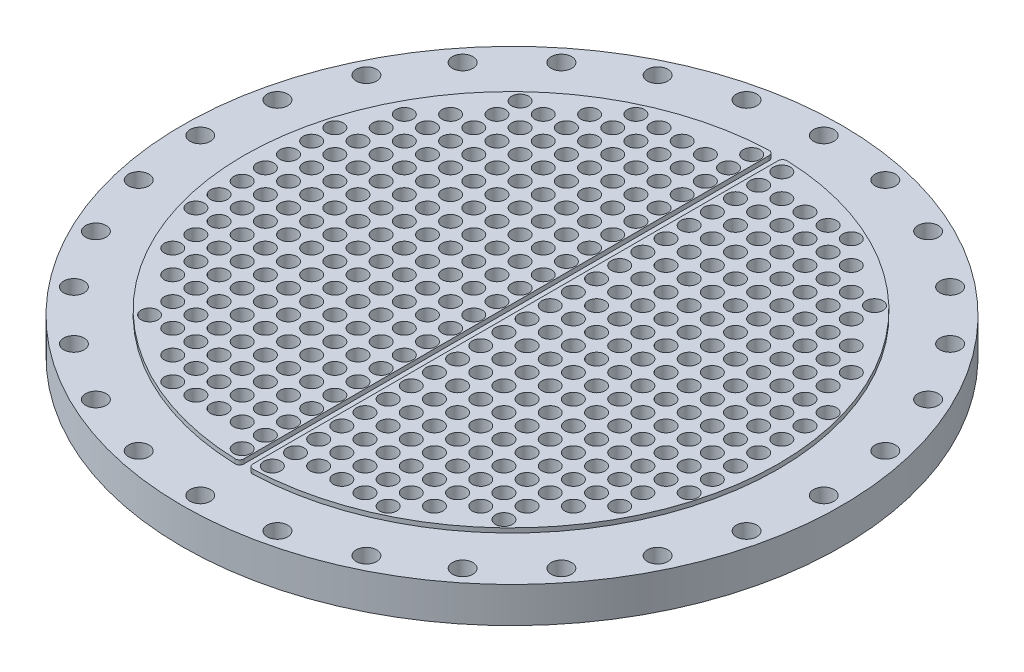
from build123d import *

# Parameters (mm, degrees)
SKETCH_2_R          = 11.5
CUT_EXTRUDE_1_DEPTH = 525.785670536
BOSS_EXTRUDE1_DEPTH = 5
SKETCH2_R           = 9.525
CUT_EXTRUDE1_DEPTH  = 526.19044165


with BuildPart() as part:
    # Эскиз1 → Повернуть1 (revolve)
    with BuildSketch(Plane.XY):
        Polygon((-300, 35), (-329, 35), (-370, 35), (-370, 75), (-300, 75), (0, 75), (0, 35), align=None)
    revolve(axis=Axis((0, 0, 0), (0, 1, 0)))

    # Эскиз2 → Вырез-Вытянуть1 (cut, through all)
    with BuildSketch(Plane(origin=(0, 75, 0), x_dir=(1, 0, 0), z_dir=(0, 1, 0))):
        with Locations((0, 350)):
            Circle(SKETCH_2_R)
        with Locations((77.882326885, 341.224769264)):
            Circle(SKETCH_2_R)
        with Locations((151.859308691, 315.339103766)):
            Circle(SKETCH_2_R)
        with Locations((218.221430651, 273.641018864)):
            Circle(SKETCH_2_R)
        with Locations((273.641018864, 218.221430651)):
            Circle(SKETCH_2_R)
        with Locations((315.339103766, 151.859308691)):
            Circle(SKETCH_2_R)
        with Locations((341.224769264, 77.882326885)):
            Circle(SKETCH_2_R)
        with Locations((350, 0)):
            Circle(SKETCH_2_R)
        with Locations((341.224769264, -77.882326885)):
            Circle(SKETCH_2_R)
        with Locations((315.339103766, -151.859308691)):
            Circle(SKETCH_2_R)
        with Locations((273.641018864, -218.221430651)):
            Circle(SKETCH_2_R)
        with Locations((218.221430651, -273.641018864)):
            Circle(SKETCH_2_R)
        with Locations((151.859308691, -315.339103766)):
            Circle(SKETCH_2_R)
        with Locations((77.882326885, -341.224769264)):
            Circle(SKETCH_2_R)
        with Locations((0, -350)):
            Circle(SKETCH_2_R)
        with Locations((-77.882326885, -341.224769264)):
            Circle(SKETCH_2_R)
        with Locations((-151.859308691, -315.339103766)):
            Circle(SKETCH_2_R)
        with Locations((-218.221430651, -273.641018864)):
            Circle(SKETCH_2_R)
        with Locations((-273.641018864, -218.221430651)):
            Circle(SKETCH_2_R)
        with Locations((-315.339103766, -151.859308691)):
            Circle(SKETCH_2_R)
        with Locations((-341.224769264, -77.882326885)):
            Circle(SKETCH_2_R)
        with Locations((-350, 0)):
            Circle(SKETCH_2_R)
        with Locations((-341.224769264, 77.882326885)):
            Circle(SKETCH_2_R)
        with Locations((-315.339103766, 151.859308691)):
            Circle(SKETCH_2_R)
        with Locations((-273.641018864, 218.221430651)):
            Circle(SKETCH_2_R)
        with Locations((-218.221430651, 273.641018864)):
            Circle(SKETCH_2_R)
        with Locations((-151.859308691, 315.339103766)):
            Circle(SKETCH_2_R)
        with Locations((-77.882326885, 341.224769264)):
            Circle(SKETCH_2_R)
    extrude(amount=-CUT_EXTRUDE_1_DEPTH, mode=Mode.SUBTRACT)

    # Sketch1 → Boss-Extrude1 (add)
    with BuildSketch(Plane(origin=(0, 75, 0), x_dir=(1, 0, 0), z_dir=(0, 1, 0))):
        with BuildLine():
            Line((3.915767562, 294.830459756), (3.915767562, -294.830459756))
            ThreePointArc((3.915767562, -294.830459756), (5.440674587, -298.425418562), (9.085259087, -299.827586193))
            ThreePointArc((9.085259087, -299.827586193), (298.915767562, 0), (9.085259087, 299.827586193))
            ThreePointArc((9.085259087, 299.827586193), (5.440674587, 298.425418562), (3.915767562, 294.830459756))
        make_face()
        with BuildLine():
            Line((-6.084232438, 294.830459756), (-6.084232438, -294.830459756))
            ThreePointArc((-6.084232438, -294.830459756), (-7.609139463, -298.425418562), (-11.253723964, -299.827586193))
            ThreePointArc((-11.253723964, -299.827586193), (-301.084232438, 0), (-11.253723964, 299.827586193))
            ThreePointArc((-11.253723964, 299.827586193), (-7.609139463, 298.425418562), (-6.084232438, 294.830459756))
        make_face()
    extrude(amount=BOSS_EXTRUDE1_DEPTH)

    # Sketch2 → Cut-Extrude1 (cut, through all)
    with BuildSketch(Plane(origin=(0, 80, 0), x_dir=(1, 0, 0), z_dir=(0, 1, 0))):
        with Locations((16.915767562, 0)):
            Circle(SKETCH2_R)
        with Locations((42.915767562, 0)):
            Circle(SKETCH2_R)
        with Locations((68.915767562, 0)):
            Circle(SKETCH2_R)
        with Locations((94.915767562, 0)):
            Circle(SKETCH2_R)
        with Locations((120.915767562, 0)):
            Circle(SKETCH2_R)
        with Locations((146.915767562, 0)):
            Circle(SKETCH2_R)
        with Locations((172.915767562, 0)):
            Circle(SKETCH2_R)
        with Locations((198.915767562, 0)):
            Circle(SKETCH2_R)
        with Locations((224.915767562, 0)):
            Circle(SKETCH2_R)
        with Locations((250.915767562, 0)):
            Circle(SKETCH2_R)
        with Locations((276.915767562, 0)):
            Circle(SKETCH2_R)
        with Locations((42.915767562, 26)):
            Circle(SKETCH2_R)
        with Locations((68.915767562, 26)):
            Circle(SKETCH2_R)
        with Locations((94.915767562, 26)):
            Circle(SKETCH2_R)
        with Locations((120.915767562, 26)):
            Circle(SKETCH2_R)
        with Locations((146.915767562, 26)):
            Circle(SKETCH2_R)
        with Locations((172.915767562, 26)):
            Circle(SKETCH2_R)
        with Locations((198.915767562, 26)):
            Circle(SKETCH2_R)
        with Locations((224.915767562, 26)):
            Circle(SKETCH2_R)
        with Locations((250.915767562, 26)):
            Circle(SKETCH2_R)
        with Locations((276.915767562, 26)):
            Circle(SKETCH2_R)
        with Locations((42.915767562, 52)):
            Circle(SKETCH2_R)
        with Locations((68.915767562, 52)):
            Circle(SKETCH2_R)
        with Locations((94.915767562, 52)):
            Circle(SKETCH2_R)
        with Locations((120.915767562, 52)):
            Circle(SKETCH2_R)
        with Locations((146.915767562, 52)):
            Circle(SKETCH2_R)
        with Locations((172.915767562, 52)):
            Circle(SKETCH2_R)
        with Locations((198.915767562, 52)):
            Circle(SKETCH2_R)
        with Locations((224.915767562, 52)):
            Circle(SKETCH2_R)
        with Locations((250.915767562, 52)):
            Circle(SKETCH2_R)
        with Locations((276.915767562, 52)):
            Circle(SKETCH2_R)
        with Locations((42.915767562, 78)):
            Circle(SKETCH2_R)
        with Locations((68.915767562, 78)):
            Circle(SKETCH2_R)
        with Locations((94.915767562, 78)):
            Circle(SKETCH2_R)
        with Locations((120.915767562, 78)):
            Circle(SKETCH2_R)
        with Locations((146.915767562, 78)):
            Circle(SKETCH2_R)
        with Locations((172.915767562, 78)):
            Circle(SKETCH2_R)
        with Locations((198.915767562, 78)):
            Circle(SKETCH2_R)
        with Locations((224.915767562, 78)):
            Circle(SKETCH2_R)
        with Locations((250.915767562, 78)):
            Circle(SKETCH2_R)
        with Locations((276.915767562, 78)):
            Circle(SKETCH2_R)
        with Locations((42.915767562, 104)):
            Circle(SKETCH2_R)
        with Locations((68.915767562, 104)):
            Circle(SKETCH2_R)
        with Locations((94.915767562, 104)):
            Circle(SKETCH2_R)
        with Locations((120.915767562, 104)):
            Circle(SKETCH2_R)
        with Locations((146.915767562, 104)):
            Circle(SKETCH2_R)
        with Locations((172.915767562, 104)):
            Circle(SKETCH2_R)
        with Locations((198.915767562, 104)):
            Circle(SKETCH2_R)
        with Locations((224.915767562, 104)):
            Circle(SKETCH2_R)
        with Locations((250.915767562, 104)):
            Circle(SKETCH2_R)
        with Locations((16.915767562, -286)):
            Circle(SKETCH2_R)
        with Locations((42.915767562, 130)):
            Circle(SKETCH2_R)
        with Locations((68.915767562, 130)):
            Circle(SKETCH2_R)
        with Locations((94.915767562, 130)):
            Circle(SKETCH2_R)
        with Locations((120.915767562, 130)):
            Circle(SKETCH2_R)
        with Locations((146.915767562, 130)):
            Circle(SKETCH2_R)
        with Locations((172.915767562, 130)):
            Circle(SKETCH2_R)
        with Locations((198.915767562, 130)):
            Circle(SKETCH2_R)
        with Locations((224.915767562, 130)):
            Circle(SKETCH2_R)
        with Locations((250.915767562, 130)):
            Circle(SKETCH2_R)
        with Locations((16.915767562, -260)):
            Circle(SKETCH2_R)
        with Locations((42.915767562, 156)):
            Circle(SKETCH2_R)
        with Locations((68.915767562, 156)):
            Circle(SKETCH2_R)
        with Locations((94.915767562, 156)):
            Circle(SKETCH2_R)
        with Locations((120.915767562, 156)):
            Circle(SKETCH2_R)
        with Locations((146.915767562, 156)):
            Circle(SKETCH2_R)
        with Locations((172.915767562, 156)):
            Circle(SKETCH2_R)
        with Locations((198.915767562, 156)):
            Circle(SKETCH2_R)
        with Locations((224.915767562, 156)):
            Circle(SKETCH2_R)
        with Locations((16.915767562, -234)):
            Circle(SKETCH2_R)
        with Locations((16.915767562, -208)):
            Circle(SKETCH2_R)
        with Locations((42.915767562, 182)):
            Circle(SKETCH2_R)
        with Locations((68.915767562, 182)):
            Circle(SKETCH2_R)
        with Locations((94.915767562, 182)):
            Circle(SKETCH2_R)
        with Locations((120.915767562, 182)):
            Circle(SKETCH2_R)
        with Locations((146.915767562, 182)):
            Circle(SKETCH2_R)
        with Locations((172.915767562, 182)):
            Circle(SKETCH2_R)
        with Locations((198.915767562, 182)):
            Circle(SKETCH2_R)
        with Locations((16.915767562, -182)):
            Circle(SKETCH2_R)
        with Locations((16.915767562, -156)):
            Circle(SKETCH2_R)
        with Locations((16.915767562, -130)):
            Circle(SKETCH2_R)
        with Locations((42.915767562, 208)):
            Circle(SKETCH2_R)
        with Locations((68.915767562, 208)):
            Circle(SKETCH2_R)
        with Locations((94.915767562, 208)):
            Circle(SKETCH2_R)
        with Locations((120.915767562, 208)):
            Circle(SKETCH2_R)
        with Locations((146.915767562, 208)):
            Circle(SKETCH2_R)
        with Locations((172.915767562, 208)):
            Circle(SKETCH2_R)
        with Locations((198.915767562, 208)):
            Circle(SKETCH2_R)
        with Locations((16.915767562, -104)):
            Circle(SKETCH2_R)
        with Locations((16.915767562, -78)):
            Circle(SKETCH2_R)
        with Locations((16.915767562, -52)):
            Circle(SKETCH2_R)
        with Locations((42.915767562, 234)):
            Circle(SKETCH2_R)
        with Locations((68.915767562, 234)):
            Circle(SKETCH2_R)
        with Locations((94.915767562, 234)):
            Circle(SKETCH2_R)
        with Locations((120.915767562, 234)):
            Circle(SKETCH2_R)
        with Locations((146.915767562, 234)):
            Circle(SKETCH2_R)
        with Locations((16.915767562, -26)):
            Circle(SKETCH2_R)
        with Locations((120.915767562, -260)):
            Circle(SKETCH2_R)
        with Locations((94.915767562, -260)):
            Circle(SKETCH2_R)
        with Locations((68.915767562, -260)):
            Circle(SKETCH2_R)
        with Locations((42.915767562, -260)):
            Circle(SKETCH2_R)
        with Locations((42.915767562, 260)):
            Circle(SKETCH2_R)
        with Locations((68.915767562, 260)):
            Circle(SKETCH2_R)
        with Locations((94.915767562, 260)):
            Circle(SKETCH2_R)
        with Locations((120.915767562, 260)):
            Circle(SKETCH2_R)
        with Locations((146.915767562, -234)):
            Circle(SKETCH2_R)
        with Locations((120.915767562, -234)):
            Circle(SKETCH2_R)
        with Locations((94.915767562, -234)):
            Circle(SKETCH2_R)
        with Locations((68.915767562, -234)):
            Circle(SKETCH2_R)
        with Locations((42.915767562, -234)):
            Circle(SKETCH2_R)
        with Locations((198.915767562, -208)):
            Circle(SKETCH2_R)
        with Locations((172.915767562, -208)):
            Circle(SKETCH2_R)
        with Locations((146.915767562, -208)):
            Circle(SKETCH2_R)
        with Locations((120.915767562, -208)):
            Circle(SKETCH2_R)
        with Locations((94.915767562, -208)):
            Circle(SKETCH2_R)
        with Locations((68.915767562, -208)):
            Circle(SKETCH2_R)
        with Locations((42.915767562, -208)):
            Circle(SKETCH2_R)
        with Locations((198.915767562, -182)):
            Circle(SKETCH2_R)
        with Locations((172.915767562, -182)):
            Circle(SKETCH2_R)
        with Locations((146.915767562, -182)):
            Circle(SKETCH2_R)
        with Locations((120.915767562, -182)):
            Circle(SKETCH2_R)
        with Locations((16.915767562, 26)):
            Circle(SKETCH2_R)
        with Locations((16.915767562, 52)):
            Circle(SKETCH2_R)
        with Locations((16.915767562, 78)):
            Circle(SKETCH2_R)
        with Locations((16.915767562, 104)):
            Circle(SKETCH2_R)
        with Locations((16.915767562, 130)):
            Circle(SKETCH2_R)
        with Locations((16.915767562, 156)):
            Circle(SKETCH2_R)
        with Locations((16.915767562, 182)):
            Circle(SKETCH2_R)
        with Locations((16.915767562, 208)):
            Circle(SKETCH2_R)
        with Locations((16.915767562, 234)):
            Circle(SKETCH2_R)
        with Locations((16.915767562, 260)):
            Circle(SKETCH2_R)
        with Locations((16.915767562, 286)):
            Circle(SKETCH2_R)
        with Locations((94.915767562, -182)):
            Circle(SKETCH2_R)
        with Locations((68.915767562, -182)):
            Circle(SKETCH2_R)
        with Locations((42.915767562, -182)):
            Circle(SKETCH2_R)
        with Locations((224.915767562, -156)):
            Circle(SKETCH2_R)
        with Locations((198.915767562, -156)):
            Circle(SKETCH2_R)
        with Locations((172.915767562, -156)):
            Circle(SKETCH2_R)
        with Locations((146.915767562, -156)):
            Circle(SKETCH2_R)
        with Locations((120.915767562, -156)):
            Circle(SKETCH2_R)
        with Locations((94.915767562, -156)):
            Circle(SKETCH2_R)
        with Locations((68.915767562, -156)):
            Circle(SKETCH2_R)
        with Locations((42.915767562, -156)):
            Circle(SKETCH2_R)
        with Locations((250.915767562, -130)):
            Circle(SKETCH2_R)
        with Locations((224.915767562, -130)):
            Circle(SKETCH2_R)
        with Locations((198.915767562, -130)):
            Circle(SKETCH2_R)
        with Locations((172.915767562, -130)):
            Circle(SKETCH2_R)
        with Locations((146.915767562, -130)):
            Circle(SKETCH2_R)
        with Locations((120.915767562, -130)):
            Circle(SKETCH2_R)
        with Locations((94.915767562, -130)):
            Circle(SKETCH2_R)
        with Locations((68.915767562, -130)):
            Circle(SKETCH2_R)
        with Locations((42.915767562, -130)):
            Circle(SKETCH2_R)
        with Locations((250.915767562, -104)):
            Circle(SKETCH2_R)
        with Locations((224.915767562, -104)):
            Circle(SKETCH2_R)
        with Locations((198.915767562, -104)):
            Circle(SKETCH2_R)
        with Locations((172.915767562, -104)):
            Circle(SKETCH2_R)
        with Locations((146.915767562, -104)):
            Circle(SKETCH2_R)
        with Locations((120.915767562, -104)):
            Circle(SKETCH2_R)
        with Locations((94.915767562, -104)):
            Circle(SKETCH2_R)
        with Locations((68.915767562, -104)):
            Circle(SKETCH2_R)
        with Locations((42.915767562, -104)):
            Circle(SKETCH2_R)
        with Locations((276.915767562, -78)):
            Circle(SKETCH2_R)
        with Locations((250.915767562, -78)):
            Circle(SKETCH2_R)
        with Locations((224.915767562, -78)):
            Circle(SKETCH2_R)
        with Locations((198.915767562, -78)):
            Circle(SKETCH2_R)
        with Locations((172.915767562, -78)):
            Circle(SKETCH2_R)
        with Locations((146.915767562, -78)):
            Circle(SKETCH2_R)
        with Locations((120.915767562, -78)):
            Circle(SKETCH2_R)
        with Locations((94.915767562, -78)):
            Circle(SKETCH2_R)
        with Locations((68.915767562, -78)):
            Circle(SKETCH2_R)
        with Locations((42.915767562, -78)):
            Circle(SKETCH2_R)
        with Locations((276.915767562, -52)):
            Circle(SKETCH2_R)
        with Locations((250.915767562, -52)):
            Circle(SKETCH2_R)
        with Locations((224.915767562, -52)):
            Circle(SKETCH2_R)
        with Locations((198.915767562, -52)):
            Circle(SKETCH2_R)
        with Locations((172.915767562, -52)):
            Circle(SKETCH2_R)
        with Locations((146.915767562, -52)):
            Circle(SKETCH2_R)
        with Locations((120.915767562, -52)):
            Circle(SKETCH2_R)
        with Locations((94.915767562, -52)):
            Circle(SKETCH2_R)
        with Locations((68.915767562, -52)):
            Circle(SKETCH2_R)
        with Locations((42.915767562, -52)):
            Circle(SKETCH2_R)
        with Locations((276.915767562, -26)):
            Circle(SKETCH2_R)
        with Locations((250.915767562, -26)):
            Circle(SKETCH2_R)
        with Locations((224.915767562, -26)):
            Circle(SKETCH2_R)
        with Locations((198.915767562, -26)):
            Circle(SKETCH2_R)
        with Locations((172.915767562, -26)):
            Circle(SKETCH2_R)
        with Locations((146.915767562, -26)):
            Circle(SKETCH2_R)
        with Locations((120.915767562, -26)):
            Circle(SKETCH2_R)
        with Locations((94.915767562, -26)):
            Circle(SKETCH2_R)
        with Locations((68.915767562, -26)):
            Circle(SKETCH2_R)
        with Locations((42.915767562, -26)):
            Circle(SKETCH2_R)
        with Locations((-42.915767562, -26)):
            Circle(SKETCH2_R)
        with Locations((-68.915767562, -26)):
            Circle(SKETCH2_R)
        with Locations((-94.915767562, -26)):
            Circle(SKETCH2_R)
        with Locations((-120.915767562, -26)):
            Circle(SKETCH2_R)
        with Locations((-146.915767562, -26)):
            Circle(SKETCH2_R)
        with Locations((-172.915767562, -26)):
            Circle(SKETCH2_R)
        with Locations((-198.915767562, -26)):
            Circle(SKETCH2_R)
        with Locations((-224.915767562, -26)):
            Circle(SKETCH2_R)
        with Locations((-250.915767562, -26)):
            Circle(SKETCH2_R)
        with Locations((-276.915767562, -26)):
            Circle(SKETCH2_R)
        with Locations((-42.915767562, -52)):
            Circle(SKETCH2_R)
        with Locations((-68.915767562, -52)):
            Circle(SKETCH2_R)
        with Locations((-94.915767562, -52)):
            Circle(SKETCH2_R)
        with Locations((-120.915767562, -52)):
            Circle(SKETCH2_R)
        with Locations((-146.915767562, -52)):
            Circle(SKETCH2_R)
        with Locations((-172.915767562, -52)):
            Circle(SKETCH2_R)
        with Locations((-198.915767562, -52)):
            Circle(SKETCH2_R)
        with Locations((-224.915767562, -52)):
            Circle(SKETCH2_R)
        with Locations((-250.915767562, -52)):
            Circle(SKETCH2_R)
        with Locations((-276.915767562, -52)):
            Circle(SKETCH2_R)
        with Locations((-42.915767562, -78)):
            Circle(SKETCH2_R)
        with Locations((-68.915767562, -78)):
            Circle(SKETCH2_R)
        with Locations((-94.915767562, -78)):
            Circle(SKETCH2_R)
        with Locations((-120.915767562, -78)):
            Circle(SKETCH2_R)
        with Locations((-146.915767562, -78)):
            Circle(SKETCH2_R)
        with Locations((-172.915767562, -78)):
            Circle(SKETCH2_R)
        with Locations((-198.915767562, -78)):
            Circle(SKETCH2_R)
        with Locations((-224.915767562, -78)):
            Circle(SKETCH2_R)
        with Locations((-250.915767562, -78)):
            Circle(SKETCH2_R)
        with Locations((-276.915767562, -78)):
            Circle(SKETCH2_R)
        with Locations((-42.915767562, -104)):
            Circle(SKETCH2_R)
        with Locations((-68.915767562, -104)):
            Circle(SKETCH2_R)
        with Locations((-94.915767562, -104)):
            Circle(SKETCH2_R)
        with Locations((-120.915767562, -104)):
            Circle(SKETCH2_R)
        with Locations((-146.915767562, -104)):
            Circle(SKETCH2_R)
        with Locations((-172.915767562, -104)):
            Circle(SKETCH2_R)
        with Locations((-198.915767562, -104)):
            Circle(SKETCH2_R)
        with Locations((-224.915767562, -104)):
            Circle(SKETCH2_R)
        with Locations((-250.915767562, -104)):
            Circle(SKETCH2_R)
        with Locations((-42.915767562, -130)):
            Circle(SKETCH2_R)
        with Locations((-68.915767562, -130)):
            Circle(SKETCH2_R)
        with Locations((-94.915767562, -130)):
            Circle(SKETCH2_R)
        with Locations((-120.915767562, -130)):
            Circle(SKETCH2_R)
        with Locations((-146.915767562, -130)):
            Circle(SKETCH2_R)
        with Locations((-172.915767562, -130)):
            Circle(SKETCH2_R)
        with Locations((-198.915767562, -130)):
            Circle(SKETCH2_R)
        with Locations((-224.915767562, -130)):
            Circle(SKETCH2_R)
        with Locations((-250.915767562, -130)):
            Circle(SKETCH2_R)
        with Locations((-42.915767562, -156)):
            Circle(SKETCH2_R)
        with Locations((-68.915767562, -156)):
            Circle(SKETCH2_R)
        with Locations((-94.915767562, -156)):
            Circle(SKETCH2_R)
        with Locations((-120.915767562, -156)):
            Circle(SKETCH2_R)
        with Locations((-146.915767562, -156)):
            Circle(SKETCH2_R)
        with Locations((-172.915767562, -156)):
            Circle(SKETCH2_R)
        with Locations((-198.915767562, -156)):
            Circle(SKETCH2_R)
        with Locations((-224.915767562, -156)):
            Circle(SKETCH2_R)
        with Locations((-42.915767562, -182)):
            Circle(SKETCH2_R)
        with Locations((-68.915767562, -182)):
            Circle(SKETCH2_R)
        with Locations((-94.915767562, -182)):
            Circle(SKETCH2_R)
        with Locations((-16.915767562, 286)):
            Circle(SKETCH2_R)
        with Locations((-16.915767562, 260)):
            Circle(SKETCH2_R)
        with Locations((-16.915767562, 234)):
            Circle(SKETCH2_R)
        with Locations((-16.915767562, 208)):
            Circle(SKETCH2_R)
        with Locations((-16.915767562, 182)):
            Circle(SKETCH2_R)
        with Locations((-16.915767562, 156)):
            Circle(SKETCH2_R)
        with Locations((-16.915767562, 130)):
            Circle(SKETCH2_R)
        with Locations((-16.915767562, 104)):
            Circle(SKETCH2_R)
        with Locations((-16.915767562, 78)):
            Circle(SKETCH2_R)
        with Locations((-16.915767562, 52)):
            Circle(SKETCH2_R)
        with Locations((-16.915767562, 26)):
            Circle(SKETCH2_R)
        with Locations((-120.915767562, -182)):
            Circle(SKETCH2_R)
        with Locations((-146.915767562, -182)):
            Circle(SKETCH2_R)
        with Locations((-172.915767562, -182)):
            Circle(SKETCH2_R)
        with Locations((-198.915767562, -182)):
            Circle(SKETCH2_R)
        with Locations((-42.915767562, -208)):
            Circle(SKETCH2_R)
        with Locations((-68.915767562, -208)):
            Circle(SKETCH2_R)
        with Locations((-94.915767562, -208)):
            Circle(SKETCH2_R)
        with Locations((-120.915767562, -208)):
            Circle(SKETCH2_R)
        with Locations((-146.915767562, -208)):
            Circle(SKETCH2_R)
        with Locations((-172.915767562, -208)):
            Circle(SKETCH2_R)
        with Locations((-198.915767562, -208)):
            Circle(SKETCH2_R)
        with Locations((-42.915767562, -234)):
            Circle(SKETCH2_R)
        with Locations((-68.915767562, -234)):
            Circle(SKETCH2_R)
        with Locations((-94.915767562, -234)):
            Circle(SKETCH2_R)
        with Locations((-120.915767562, -234)):
            Circle(SKETCH2_R)
        with Locations((-146.915767562, -234)):
            Circle(SKETCH2_R)
        with Locations((-120.915767562, 260)):
            Circle(SKETCH2_R)
        with Locations((-94.915767562, 260)):
            Circle(SKETCH2_R)
        with Locations((-68.915767562, 260)):
            Circle(SKETCH2_R)
        with Locations((-42.915767562, 260)):
            Circle(SKETCH2_R)
        with Locations((-42.915767562, -260)):
            Circle(SKETCH2_R)
        with Locations((-68.915767562, -260)):
            Circle(SKETCH2_R)
        with Locations((-94.915767562, -260)):
            Circle(SKETCH2_R)
        with Locations((-120.915767562, -260)):
            Circle(SKETCH2_R)
        with Locations((-16.915767562, -26)):
            Circle(SKETCH2_R)
        with Locations((-146.915767562, 234)):
            Circle(SKETCH2_R)
        with Locations((-120.915767562, 234)):
            Circle(SKETCH2_R)
        with Locations((-94.915767562, 234)):
            Circle(SKETCH2_R)
        with Locations((-68.915767562, 234)):
            Circle(SKETCH2_R)
        with Locations((-42.915767562, 234)):
            Circle(SKETCH2_R)
        with Locations((-16.915767562, -52)):
            Circle(SKETCH2_R)
        with Locations((-16.915767562, -78)):
            Circle(SKETCH2_R)
        with Locations((-16.915767562, -104)):
            Circle(SKETCH2_R)
        with Locations((-198.915767562, 208)):
            Circle(SKETCH2_R)
        with Locations((-172.915767562, 208)):
            Circle(SKETCH2_R)
        with Locations((-146.915767562, 208)):
            Circle(SKETCH2_R)
        with Locations((-120.915767562, 208)):
            Circle(SKETCH2_R)
        with Locations((-94.915767562, 208)):
            Circle(SKETCH2_R)
        with Locations((-68.915767562, 208)):
            Circle(SKETCH2_R)
        with Locations((-42.915767562, 208)):
            Circle(SKETCH2_R)
        with Locations((-16.915767562, -130)):
            Circle(SKETCH2_R)
        with Locations((-16.915767562, -156)):
            Circle(SKETCH2_R)
        with Locations((-16.915767562, -182)):
            Circle(SKETCH2_R)
        with Locations((-198.915767562, 182)):
            Circle(SKETCH2_R)
        with Locations((-172.915767562, 182)):
            Circle(SKETCH2_R)
        with Locations((-146.915767562, 182)):
            Circle(SKETCH2_R)
        with Locations((-120.915767562, 182)):
            Circle(SKETCH2_R)
        with Locations((-94.915767562, 182)):
            Circle(SKETCH2_R)
        with Locations((-68.915767562, 182)):
            Circle(SKETCH2_R)
        with Locations((-42.915767562, 182)):
            Circle(SKETCH2_R)
        with Locations((-16.915767562, -208)):
            Circle(SKETCH2_R)
        with Locations((-16.915767562, -234)):
            Circle(SKETCH2_R)
        with Locations((-224.915767562, 156)):
            Circle(SKETCH2_R)
        with Locations((-198.915767562, 156)):
            Circle(SKETCH2_R)
        with Locations((-172.915767562, 156)):
            Circle(SKETCH2_R)
        with Locations((-146.915767562, 156)):
            Circle(SKETCH2_R)
        with Locations((-120.915767562, 156)):
            Circle(SKETCH2_R)
        with Locations((-94.915767562, 156)):
            Circle(SKETCH2_R)
        with Locations((-68.915767562, 156)):
            Circle(SKETCH2_R)
        with Locations((-42.915767562, 156)):
            Circle(SKETCH2_R)
        with Locations((-16.915767562, -260)):
            Circle(SKETCH2_R)
        with Locations((-250.915767562, 130)):
            Circle(SKETCH2_R)
        with Locations((-224.915767562, 130)):
            Circle(SKETCH2_R)
        with Locations((-198.915767562, 130)):
            Circle(SKETCH2_R)
        with Locations((-172.915767562, 130)):
            Circle(SKETCH2_R)
        with Locations((-146.915767562, 130)):
            Circle(SKETCH2_R)
        with Locations((-120.915767562, 130)):
            Circle(SKETCH2_R)
        with Locations((-94.915767562, 130)):
            Circle(SKETCH2_R)
        with Locations((-68.915767562, 130)):
            Circle(SKETCH2_R)
        with Locations((-42.915767562, 130)):
            Circle(SKETCH2_R)
        with Locations((-16.915767562, -286)):
            Circle(SKETCH2_R)
        with Locations((-250.915767562, 104)):
            Circle(SKETCH2_R)
        with Locations((-224.915767562, 104)):
            Circle(SKETCH2_R)
        with Locations((-198.915767562, 104)):
            Circle(SKETCH2_R)
        with Locations((-172.915767562, 104)):
            Circle(SKETCH2_R)
        with Locations((-146.915767562, 104)):
            Circle(SKETCH2_R)
        with Locations((-120.915767562, 104)):
            Circle(SKETCH2_R)
        with Locations((-94.915767562, 104)):
            Circle(SKETCH2_R)
        with Locations((-68.915767562, 104)):
            Circle(SKETCH2_R)
        with Locations((-42.915767562, 104)):
            Circle(SKETCH2_R)
        with Locations((-276.915767562, 78)):
            Circle(SKETCH2_R)
        with Locations((-250.915767562, 78)):
            Circle(SKETCH2_R)
        with Locations((-224.915767562, 78)):
            Circle(SKETCH2_R)
        with Locations((-198.915767562, 78)):
            Circle(SKETCH2_R)
        with Locations((-172.915767562, 78)):
            Circle(SKETCH2_R)
        with Locations((-146.915767562, 78)):
            Circle(SKETCH2_R)
        with Locations((-120.915767562, 78)):
            Circle(SKETCH2_R)
        with Locations((-94.915767562, 78)):
            Circle(SKETCH2_R)
        with Locations((-68.915767562, 78)):
            Circle(SKETCH2_R)
        with Locations((-42.915767562, 78)):
            Circle(SKETCH2_R)
        with Locations((-276.915767562, 52)):
            Circle(SKETCH2_R)
        with Locations((-250.915767562, 52)):
            Circle(SKETCH2_R)
        with Locations((-224.915767562, 52)):
            Circle(SKETCH2_R)
        with Locations((-198.915767562, 52)):
            Circle(SKETCH2_R)
        with Locations((-172.915767562, 52)):
            Circle(SKETCH2_R)
        with Locations((-146.915767562, 52)):
            Circle(SKETCH2_R)
        with Locations((-120.915767562, 52)):
            Circle(SKETCH2_R)
        with Locations((-94.915767562, 52)):
            Circle(SKETCH2_R)
        with Locations((-68.915767562, 52)):
            Circle(SKETCH2_R)
        with Locations((-42.915767562, 52)):
            Circle(SKETCH2_R)
        with Locations((-276.915767562, 26)):
            Circle(SKETCH2_R)
        with Locations((-250.915767562, 26)):
            Circle(SKETCH2_R)
        with Locations((-224.915767562, 26)):
            Circle(SKETCH2_R)
        with Locations((-198.915767562, 26)):
            Circle(SKETCH2_R)
        with Locations((-172.915767562, 26)):
            Circle(SKETCH2_R)
        with Locations((-146.915767562, 26)):
            Circle(SKETCH2_R)
        with Locations((-120.915767562, 26)):
            Circle(SKETCH2_R)
        with Locations((-94.915767562, 26)):
            Circle(SKETCH2_R)
        with Locations((-68.915767562, 26)):
            Circle(SKETCH2_R)
        with Locations((-42.915767562, 26)):
            Circle(SKETCH2_R)
        with Locations((-276.915767562, 0)):
            Circle(SKETCH2_R)
        with Locations((-250.915767562, 0)):
            Circle(SKETCH2_R)
        with Locations((-224.915767562, 0)):
            Circle(SKETCH2_R)
        with Locations((-198.915767562, 0)):
            Circle(SKETCH2_R)
        with Locations((-172.915767562, 0)):
            Circle(SKETCH2_R)
        with Locations((-146.915767562, 0)):
            Circle(SKETCH2_R)
        with Locations((-120.915767562, 0)):
            Circle(SKETCH2_R)
        with Locations((-94.915767562, 0)):
            Circle(SKETCH2_R)
        with Locations((-68.915767562, 0)):
            Circle(SKETCH2_R)
        with Locations((-42.915767562, 0)):
            Circle(SKETCH2_R)
        with Locations((-16.915767562, 0)):
            Circle(SKETCH2_R)
    extrude(amount=-CUT_EXTRUDE1_DEPTH, mode=Mode.SUBTRACT)


solid = part.part
